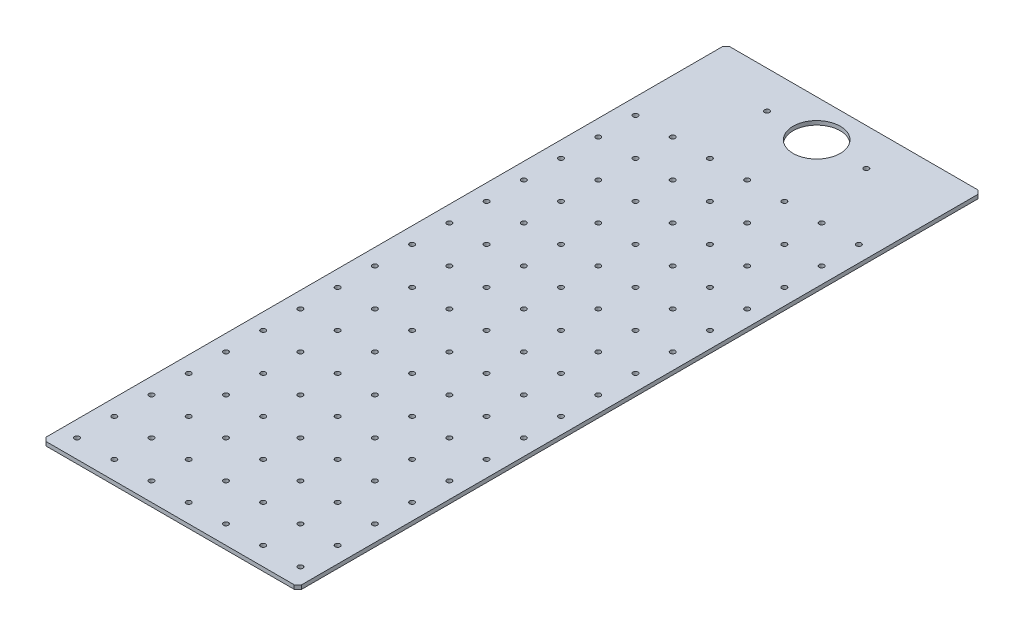
from build123d import *

# Parameters (mm, degrees)
SKETCH_1_W             = 206
SKETCH_1_H             = 551
EXTRUDE_1_DEPTH        = 3.2
SKETCH_2_R             = 19
SKETCH_2_R_2           = 2
CUT_EXTRUDE_1_DEPTH    = 295.141955525
SKETCH_3_R             = 2
CUT_EXTRUDE_1419_DEPTH = 295.141955525
CHAMFER_1_SIZE         = 3


with BuildPart() as part:
    # ｽｹｯﾁ1 → ﾎﾞｽ - 押し出し1 (new body)
    with BuildSketch(Plane(origin=(0, 0, 0), x_dir=(1, 0, 0), z_dir=(0, 1, 0))):
        Rectangle(SKETCH_1_W, SKETCH_1_H)
    extrude(amount=EXTRUDE_1_DEPTH)

    # ｽｹｯﾁ2 → ｶｯﾄ - 押し出し1 (cut, through all)
    with BuildSketch(Plane(origin=(0, 3.2, 0), x_dir=(1, 0, 0), z_dir=(0, 1, 0))):
        with Locations(Location((0, 245.5, 0), (0, 0, 270))):
            Circle(SKETCH_2_R)
        with Locations(Location((-40, 245.5, 0), (0, 0, 270))):
            Circle(SKETCH_2_R_2)
        with Locations(Location((40, 245.5, 0), (0, 0, 270))):
            Circle(SKETCH_2_R_2)
    extrude(amount=-CUT_EXTRUDE_1_DEPTH, mode=Mode.SUBTRACT)

    # ｽｹｯﾁ3 → Cut-Extrude 1419 (cut, through all)
    with BuildSketch(Plane(origin=(0, 3.2, 0), x_dir=(1, 0, 0), z_dir=(0, 1, 0))):
        with Locations(Location((-90, -260.5, 0), (0, 0, 270))):
            Circle(SKETCH_3_R)
        with Locations(Location((-60, -260.5, 0), (0, 0, 270))):
            Circle(SKETCH_3_R)
        with Locations(Location((-30, -260.5, 0), (0, 0, 270))):
            Circle(SKETCH_3_R)
        with Locations(Location((0, -260.5, 0), (0, 0, 270))):
            Circle(SKETCH_3_R)
        with Locations(Location((30, -260.5, 0), (0, 0, 270))):
            Circle(SKETCH_3_R)
        with Locations(Location((60, -260.5, 0), (0, 0, 270))):
            Circle(SKETCH_3_R)
        with Locations(Location((90, -260.5, 0), (0, 0, 270))):
            Circle(SKETCH_3_R)
        with Locations(Location((-60, -230.5, 0), (0, 0, 270))):
            Circle(SKETCH_3_R)
        with Locations(Location((-30, -230.5, 0), (0, 0, 270))):
            Circle(SKETCH_3_R)
        with Locations(Location((0, -230.5, 0), (0, 0, 270))):
            Circle(SKETCH_3_R)
        with Locations(Location((30, -230.5, 0), (0, 0, 270))):
            Circle(SKETCH_3_R)
        with Locations(Location((60, -230.5, 0), (0, 0, 270))):
            Circle(SKETCH_3_R)
        with Locations(Location((90, -230.5, 0), (0, 0, 270))):
            Circle(SKETCH_3_R)
        with Locations(Location((-60, -200.5, 0), (0, 0, 270))):
            Circle(SKETCH_3_R)
        with Locations(Location((-30, -200.5, 0), (0, 0, 270))):
            Circle(SKETCH_3_R)
        with Locations(Location((0, -200.5, 0), (0, 0, 270))):
            Circle(SKETCH_3_R)
        with Locations(Location((30, -200.5, 0), (0, 0, 270))):
            Circle(SKETCH_3_R)
        with Locations(Location((60, -200.5, 0), (0, 0, 270))):
            Circle(SKETCH_3_R)
        with Locations(Location((90, -200.5, 0), (0, 0, 270))):
            Circle(SKETCH_3_R)
        with Locations(Location((-60, -170.5, 0), (0, 0, 270))):
            Circle(SKETCH_3_R)
        with Locations(Location((-30, -170.5, 0), (0, 0, 270))):
            Circle(SKETCH_3_R)
        with Locations(Location((0, -170.5, 0), (0, 0, 270))):
            Circle(SKETCH_3_R)
        with Locations(Location((30, -170.5, 0), (0, 0, 270))):
            Circle(SKETCH_3_R)
        with Locations(Location((60, -170.5, 0), (0, 0, 270))):
            Circle(SKETCH_3_R)
        with Locations(Location((90, -170.5, 0), (0, 0, 270))):
            Circle(SKETCH_3_R)
        with Locations(Location((-60, -140.5, 0), (0, 0, 270))):
            Circle(SKETCH_3_R)
        with Locations(Location((-30, -140.5, 0), (0, 0, 270))):
            Circle(SKETCH_3_R)
        with Locations(Location((0, -140.5, 0), (0, 0, 270))):
            Circle(SKETCH_3_R)
        with Locations(Location((30, -140.5, 0), (0, 0, 270))):
            Circle(SKETCH_3_R)
        with Locations(Location((60, -140.5, 0), (0, 0, 270))):
            Circle(SKETCH_3_R)
        with Locations(Location((90, -140.5, 0), (0, 0, 270))):
            Circle(SKETCH_3_R)
        with Locations(Location((-60, -110.5, 0), (0, 0, 270))):
            Circle(SKETCH_3_R)
        with Locations(Location((-30, -110.5, 0), (0, 0, 270))):
            Circle(SKETCH_3_R)
        with Locations(Location((0, -110.5, 0), (0, 0, 270))):
            Circle(SKETCH_3_R)
        with Locations(Location((30, -110.5, 0), (0, 0, 270))):
            Circle(SKETCH_3_R)
        with Locations(Location((60, -110.5, 0), (0, 0, 270))):
            Circle(SKETCH_3_R)
        with Locations(Location((90, -110.5, 0), (0, 0, 270))):
            Circle(SKETCH_3_R)
        with Locations(Location((-90, -230.5, 0), (0, 0, 270))):
            Circle(SKETCH_3_R)
        with Locations(Location((-90, -200.5, 0), (0, 0, 270))):
            Circle(SKETCH_3_R)
        with Locations(Location((-90, -170.5, 0), (0, 0, 270))):
            Circle(SKETCH_3_R)
        with Locations(Location((-90, -140.5, 0), (0, 0, 270))):
            Circle(SKETCH_3_R)
        with Locations(Location((-90, -110.5, 0), (0, 0, 270))):
            Circle(SKETCH_3_R)
        with Locations(Location((-90, -80.5, 0), (0, 0, 270))):
            Circle(SKETCH_3_R)
        with Locations(Location((-60, -80.5, 0), (0, 0, 270))):
            Circle(SKETCH_3_R)
        with Locations(Location((-30, -80.5, 0), (0, 0, 270))):
            Circle(SKETCH_3_R)
        with Locations(Location((0, -80.5, 0), (0, 0, 270))):
            Circle(SKETCH_3_R)
        with Locations(Location((30, -80.5, 0), (0, 0, 270))):
            Circle(SKETCH_3_R)
        with Locations(Location((60, -80.5, 0), (0, 0, 270))):
            Circle(SKETCH_3_R)
        with Locations(Location((90, -80.5, 0), (0, 0, 270))):
            Circle(SKETCH_3_R)
        with Locations(Location((-90, -50.5, 0), (0, 0, 270))):
            Circle(SKETCH_3_R)
        with Locations(Location((-60, -50.5, 0), (0, 0, 270))):
            Circle(SKETCH_3_R)
        with Locations(Location((-30, -50.5, 0), (0, 0, 270))):
            Circle(SKETCH_3_R)
        with Locations(Location((0, -50.5, 0), (0, 0, 270))):
            Circle(SKETCH_3_R)
        with Locations(Location((30, -50.5, 0), (0, 0, 270))):
            Circle(SKETCH_3_R)
        with Locations(Location((60, -50.5, 0), (0, 0, 270))):
            Circle(SKETCH_3_R)
        with Locations(Location((90, -50.5, 0), (0, 0, 270))):
            Circle(SKETCH_3_R)
        with Locations(Location((-90, -20.5, 0), (0, 0, 270))):
            Circle(SKETCH_3_R)
        with Locations(Location((-60, -20.5, 0), (0, 0, 270))):
            Circle(SKETCH_3_R)
        with Locations(Location((-30, -20.5, 0), (0, 0, 270))):
            Circle(SKETCH_3_R)
        with Locations(Location((0, -20.5, 0), (0, 0, 270))):
            Circle(SKETCH_3_R)
        with Locations(Location((30, -20.5, 0), (0, 0, 270))):
            Circle(SKETCH_3_R)
        with Locations(Location((60, -20.5, 0), (0, 0, 270))):
            Circle(SKETCH_3_R)
        with Locations(Location((90, -20.5, 0), (0, 0, 270))):
            Circle(SKETCH_3_R)
        with Locations(Location((-90, 9.5, 0), (0, 0, 270))):
            Circle(SKETCH_3_R)
        with Locations(Location((-60, 9.5, 0), (0, 0, 270))):
            Circle(SKETCH_3_R)
        with Locations(Location((-30, 9.5, 0), (0, 0, 270))):
            Circle(SKETCH_3_R)
        with Locations(Location((0, 9.5, 0), (0, 0, 270))):
            Circle(SKETCH_3_R)
        with Locations(Location((30, 9.5, 0), (0, 0, 270))):
            Circle(SKETCH_3_R)
        with Locations(Location((60, 9.5, 0), (0, 0, 270))):
            Circle(SKETCH_3_R)
        with Locations(Location((90, 9.5, 0), (0, 0, 270))):
            Circle(SKETCH_3_R)
        with Locations(Location((-90, 39.5, 0), (0, 0, 270))):
            Circle(SKETCH_3_R)
        with Locations(Location((-60, 39.5, 0), (0, 0, 270))):
            Circle(SKETCH_3_R)
        with Locations(Location((-30, 39.5, 0), (0, 0, 270))):
            Circle(SKETCH_3_R)
        with Locations(Location((0, 39.5, 0), (0, 0, 270))):
            Circle(SKETCH_3_R)
        with Locations(Location((30, 39.5, 0), (0, 0, 270))):
            Circle(SKETCH_3_R)
        with Locations(Location((60, 39.5, 0), (0, 0, 270))):
            Circle(SKETCH_3_R)
        with Locations(Location((90, 39.5, 0), (0, 0, 270))):
            Circle(SKETCH_3_R)
        with Locations(Location((-90, 69.5, 0), (0, 0, 270))):
            Circle(SKETCH_3_R)
        with Locations(Location((-60, 69.5, 0), (0, 0, 270))):
            Circle(SKETCH_3_R)
        with Locations(Location((-30, 69.5, 0), (0, 0, 270))):
            Circle(SKETCH_3_R)
        with Locations(Location((0, 69.5, 0), (0, 0, 270))):
            Circle(SKETCH_3_R)
        with Locations(Location((30, 69.5, 0), (0, 0, 270))):
            Circle(SKETCH_3_R)
        with Locations(Location((60, 69.5, 0), (0, 0, 270))):
            Circle(SKETCH_3_R)
        with Locations(Location((90, 69.5, 0), (0, 0, 270))):
            Circle(SKETCH_3_R)
        with Locations(Location((-90, 99.5, 0), (0, 0, 270))):
            Circle(SKETCH_3_R)
        with Locations(Location((-60, 99.5, 0), (0, 0, 270))):
            Circle(SKETCH_3_R)
        with Locations(Location((-30, 99.5, 0), (0, 0, 270))):
            Circle(SKETCH_3_R)
        with Locations(Location((0, 99.5, 0), (0, 0, 270))):
            Circle(SKETCH_3_R)
        with Locations(Location((30, 99.5, 0), (0, 0, 270))):
            Circle(SKETCH_3_R)
        with Locations(Location((60, 99.5, 0), (0, 0, 270))):
            Circle(SKETCH_3_R)
        with Locations(Location((90, 99.5, 0), (0, 0, 270))):
            Circle(SKETCH_3_R)
        with Locations(Location((-90, 129.5, 0), (0, 0, 270))):
            Circle(SKETCH_3_R)
        with Locations(Location((-60, 129.5, 0), (0, 0, 270))):
            Circle(SKETCH_3_R)
        with Locations(Location((-30, 129.5, 0), (0, 0, 270))):
            Circle(SKETCH_3_R)
        with Locations(Location((0, 129.5, 0), (0, 0, 270))):
            Circle(SKETCH_3_R)
        with Locations(Location((30, 129.5, 0), (0, 0, 270))):
            Circle(SKETCH_3_R)
        with Locations(Location((60, 129.5, 0), (0, 0, 270))):
            Circle(SKETCH_3_R)
        with Locations(Location((90, 129.5, 0), (0, 0, 270))):
            Circle(SKETCH_3_R)
        with Locations(Location((-90, 159.5, 0), (0, 0, 270))):
            Circle(SKETCH_3_R)
        with Locations(Location((-60, 159.5, 0), (0, 0, 270))):
            Circle(SKETCH_3_R)
        with Locations(Location((-30, 159.5, 0), (0, 0, 270))):
            Circle(SKETCH_3_R)
        with Locations(Location((0, 159.5, 0), (0, 0, 270))):
            Circle(SKETCH_3_R)
        with Locations(Location((30, 159.5, 0), (0, 0, 270))):
            Circle(SKETCH_3_R)
        with Locations(Location((60, 159.5, 0), (0, 0, 270))):
            Circle(SKETCH_3_R)
        with Locations(Location((90, 159.5, 0), (0, 0, 270))):
            Circle(SKETCH_3_R)
        with Locations(Location((-90, 189.5, 0), (0, 0, 270))):
            Circle(SKETCH_3_R)
        with Locations(Location((-60, 189.5, 0), (0, 0, 270))):
            Circle(SKETCH_3_R)
        with Locations(Location((-30, 189.5, 0), (0, 0, 270))):
            Circle(SKETCH_3_R)
        with Locations(Location((0, 189.5, 0), (0, 0, 270))):
            Circle(SKETCH_3_R)
        with Locations(Location((30, 189.5, 0), (0, 0, 270))):
            Circle(SKETCH_3_R)
        with Locations(Location((60, 189.5, 0), (0, 0, 270))):
            Circle(SKETCH_3_R)
        with Locations(Location((90, 189.5, 0), (0, 0, 270))):
            Circle(SKETCH_3_R)
    extrude(amount=-CUT_EXTRUDE_1419_DEPTH, mode=Mode.SUBTRACT)

    # 面取り1
    chamfer_1_edges = [part.edges().sort_by_distance(p)[0] for p in [
        (-103, 1.6, 275.5),
        (-103, 1.6, -275.5),
        (103, 1.6, -275.5),
        (103, 1.6, 275.5),
    ]]
    chamfer(chamfer_1_edges, length=CHAMFER_1_SIZE)


solid = part.part
